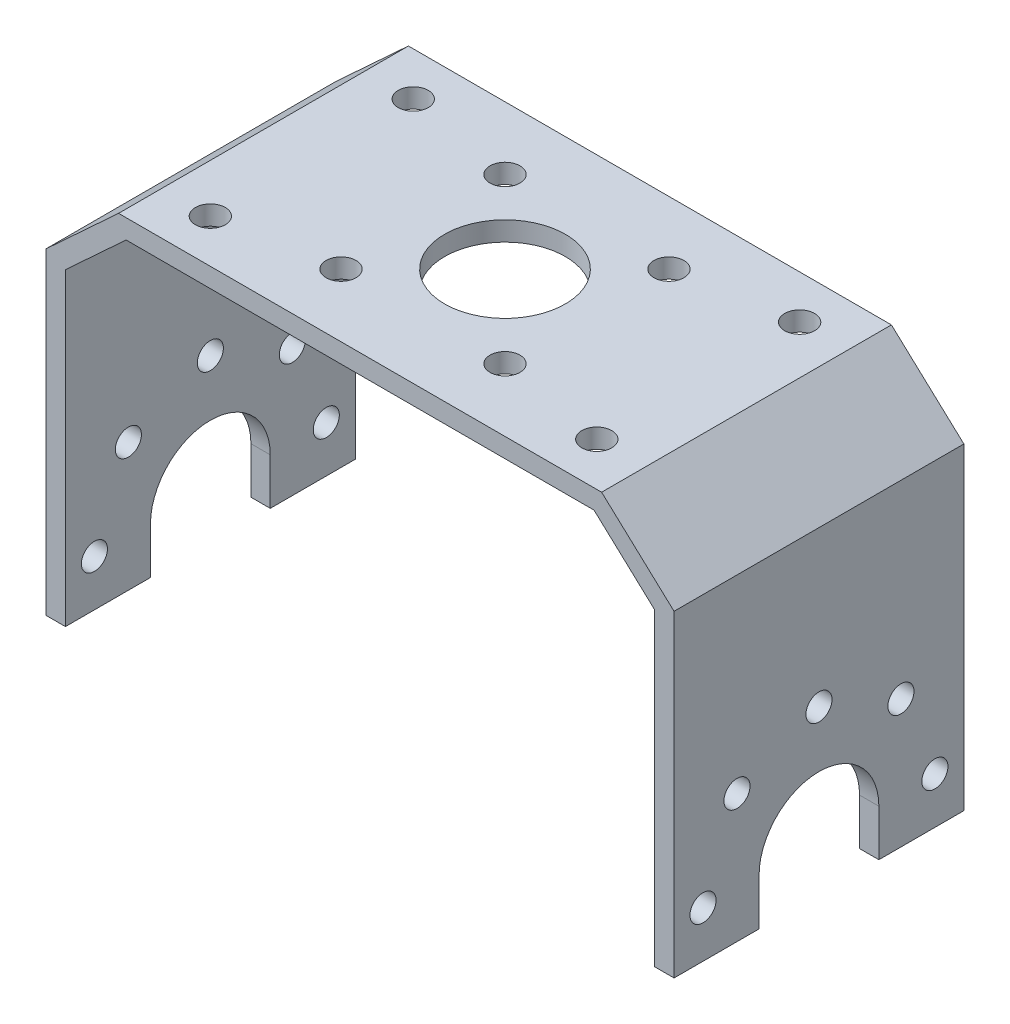
from build123d import *

# Parameters (mm, degrees)
BOSS_EXTRU_1_DEPTH      = 15
ESQUISSE3_R             = 6.25
ESQUISSE3_R_2           = 1.55
ENL_V_MAT_EXTRU_1_DEPTH = 54.528403675
ESQUISSE4_R             = 1.35
ENL_V_MAT_EXTRU_2_DEPTH = 78.679083414


with BuildPart() as part:
    # Esquisse1 → Boss.-Extru.1 (new, symmetric)
    with BuildSketch(Plane.XY):
        Polygon((-25, 39.8), (25, 39.8), (32.5, 32.875544179), (32.5, 0), (30.5, 0), (30.5, 32), (24.217917895, 37.8), (-24.217917895, 37.8), (-30.5, 32), (-30.5, 0), (-32.5, 0), (-32.5, 32.875544179), align=None)
    extrude(amount=BOSS_EXTRU_1_DEPTH, both=True)

    # Esquisse3 → Enlèv. mat.-Extru.1 (cut, through all)
    with BuildSketch(Plane(origin=(0, 39.8, 0), x_dir=(1, 0, 0), z_dir=(0, 1, 0))):
        with Locations(Location((0, 0, 0), (0, 0, 270))):
            Circle(ESQUISSE3_R)
        with Locations(Location((-8.485281374, 8.485281374, 0), (0, 0, 270))):
            Circle(ESQUISSE3_R_2)
        with Locations(Location((-8.485281374, -8.485281374, 0), (0, 0, 270))):
            Circle(ESQUISSE3_R_2)
        with Locations(Location((8.485281374, -8.485281374, 0), (0, 0, 270))):
            Circle(ESQUISSE3_R_2)
        with Locations(Location((8.485281374, 8.485281374, 0), (0, 0, 270))):
            Circle(ESQUISSE3_R_2)
        with Locations(Location((20, 10.5, 0), (0, 0, 270))):
            Circle(ESQUISSE3_R_2)
        with Locations(Location((-20, 10.5, 0), (0, 0, 270))):
            Circle(ESQUISSE3_R_2)
        with Locations(Location((20, -10.5, 0), (0, 0, 270))):
            Circle(ESQUISSE3_R_2)
        with Locations(Location((-20, -10.5, 0), (0, 0, 270))):
            Circle(ESQUISSE3_R_2)
    extrude(amount=-ENL_V_MAT_EXTRU_1_DEPTH, mode=Mode.SUBTRACT)

    # Esquisse4 → Enlèv. mat.-Extru.2 (cut, through all)
    with BuildSketch(Plane(origin=(32.5, 0, 0), x_dir=(0, 0, -1), z_dir=(1, 0, 0))):
        with Locations((-12, 4.8)):
            Circle(ESQUISSE4_R)
        with Locations((0, 16.8)):
            Circle(ESQUISSE4_R)
        with Locations((-8.485281374, 13.285281374)):
            Circle(ESQUISSE4_R)
        with Locations(Location((12, 4.8, 0), (0, 0, 180))):
            Circle(ESQUISSE4_R)
        with Locations(Location((8.485281374, 13.285281374, 0), (0, 0, 180))):
            Circle(ESQUISSE4_R)
        with BuildLine():
            Line((-6.2, 0), (-6.2, 4.8))
            ThreePointArc((-6.2, 4.8), (0, 11), (6.2, 4.8))
            Line((6.2, 4.8), (6.2, 0))
            Line((6.2, 0), (-6.2, 0))
        make_face()
    extrude(amount=-ENL_V_MAT_EXTRU_2_DEPTH, mode=Mode.SUBTRACT)


solid = part.part
